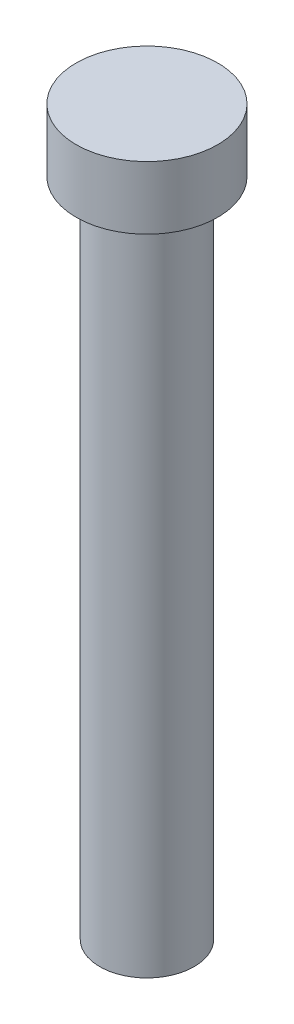
from build123d import *

# Parameters (mm, degrees)
SKETCH1_R           = 22.5
BOSS_EXTRUDE1_DEPTH = 20
SKETCH2_R           = 15
BOSS_EXTRUDE3_DEPTH = 210


with BuildPart() as part:
    # Sketch1 → Boss-Extrude1 (new body)
    with BuildSketch(Plane(origin=(0, 0, 0), x_dir=(1, 0, 0), z_dir=(0, 1, 0))):
        with Locations(Location((0, 0, 0), (0, 0, 270))):
            Circle(SKETCH1_R)
    extrude(amount=BOSS_EXTRUDE1_DEPTH)

    # Sketch2 → Boss-Extrude3 (add)
    with BuildSketch(Plane.XZ):
        with Locations(Location((0, 0, 0), (0, 0, 270))):
            Circle(SKETCH2_R)
    extrude(amount=BOSS_EXTRUDE3_DEPTH)


solid = part.part
